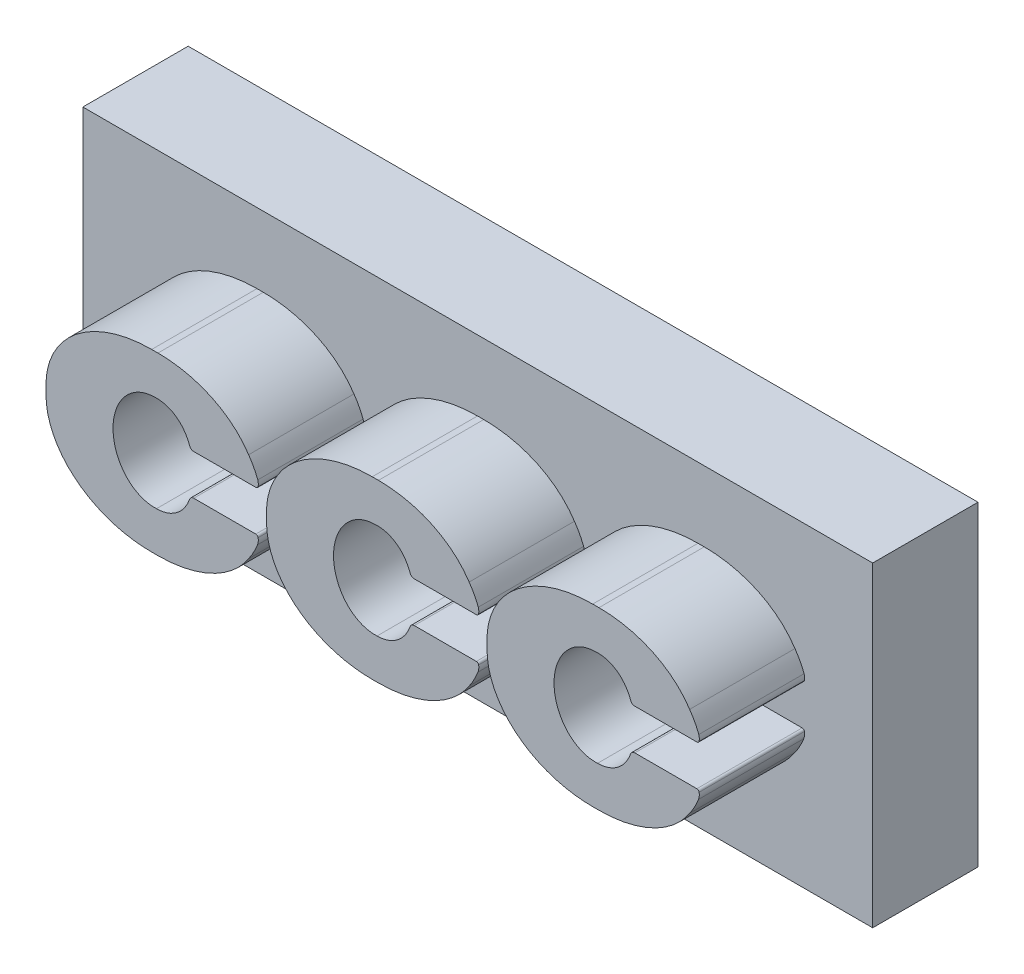
from build123d import *

# Parameters (mm, degrees)
BOSS_EXTRUDE1_DEPTH   = 2
BOSS_EXTRUDE1_2_DEPTH = 2
BOSS_EXTRUDE1_3_DEPTH = 2
SKETCH3_W             = 15
SKETCH3_H             = 6
BOSS_EXTRUDE2_DEPTH   = 2


with BuildPart() as part:
    # Sketch2 → Boss-Extrude1 (new body)
    with BuildSketch(Plane.XY):
        with BuildLine():
            Line((11.971746688, 19.734053644), (13.156348071, 19.734053669))
            ThreePointArc((13.156348071, 19.734053669), (13.179525443, 19.744291413), (13.193365664, 19.765515226))
            ThreePointArc((13.193365664, 19.765515226), (13.19739915, 19.821201025), (13.188063691, 19.8762467))
            ThreePointArc((13.188063691, 19.8762467), (13.111547426, 20.044582448), (13.014440765, 20.20194178))
            add(Edge.make_bspline(
                [(13.014440765, 20.20194178), (12.484950193, 21.013504257), (11.291530639, 21.013504258)],
                knots=[0.342748392, 0.342748392, 0.342748392, 1.381331673, 1.381331673, 1.381331673], degree=2, weights=[1, 0.868170932, 1]))
            Line((11.291530639, 21.013504258), (11.173022933, 21.013504277))
            add(Edge.make_bspline(
                [(11.173022933, 21.013504277), (9.165862366, 21.013504277), (9.16586234, 19.429763689)],
                knots=[4.81203319, 4.81203319, 4.81203319, 6.344970319, 6.344970319, 6.344970319], degree=2, weights=[1, 0.720364545, 1]))
            Line((9.16586234, 19.429763689), (9.165862348, 19.265041834))
            add(Edge.make_bspline(
                [(9.165862348, 19.265041834), (9.165862348, 17.681301204), (11.173022971, 17.681301277)],
                knots=[3.079807634, 3.079807634, 3.079807634, 4.612744788, 4.612744788, 4.612744788], degree=2, weights=[1, 0.720364536, 1]))
            Line((11.173022971, 17.681301277), (11.291530595, 17.681301231))
            add(Edge.make_bspline(
                [(11.291530595, 17.681301231), (12.48495018, 17.681301231), (13.014440765, 18.492863728)],
                knots=[1.760260959, 1.760260959, 1.760260959, 2.798844261, 2.798844261, 2.798844261], degree=2, weights=[1, 0.868170926, 1]))
            ThreePointArc((13.014440765, 18.492863728), (13.107795315, 18.64362681), (13.182053506, 18.804655688))
            ThreePointArc((13.182053506, 18.804655688), (13.196728173, 18.865824439), (13.194497656, 18.928689268))
            ThreePointArc((13.194497656, 18.928689268), (13.179302023, 18.955174053), (13.150618481, 18.965643321))
            Line((13.150618481, 18.965643321), (11.971746647, 18.965643321))
            ThreePointArc((11.971746647, 18.965643321), (11.923939268, 18.950452436), (11.893668965, 18.91045222))
            add(Edge.make_bspline(
                [(11.265198612, 18.440979368), (11.727360525, 18.440524679), (11.893668965, 18.91045222)],
                knots=[5.955155363, 5.955155363, 5.955155363, 7.020735544, 7.020735544, 7.020735544], degree=2, weights=[1, 0.86139323, 1]))
            add(Edge.make_bspline(
                [(11.189511072, 20.254442875), (10.402055714, 20.214623084), (10.44001251, 19.305183226), (10.477969307, 18.395743368), (11.265198612, 18.440979368)],
                knots=[3.181025595, 3.181025595, 3.181025595, 4.754799698, 4.754799698, 6.328573801, 6.328573801, 6.328573801], degree=2, weights=[1, 0.706053195, 1, 0.706053195, 1]))
            add(Edge.make_bspline(
                [(11.893668965, 19.789244771), (11.708556533, 20.312305593), (11.189511072, 20.254442875)],
                knots=[2.404042417, 2.404042417, 2.404042417, 3.565685694, 3.565685694, 3.565685694], degree=2, weights=[1, 0.83601209, 1]))
            ThreePointArc((11.893668965, 19.789244771), (11.923939288, 19.749244541), (11.971746688, 19.734053644))
        make_face()
    extrude(amount=BOSS_EXTRUDE1_DEPTH)



with BuildPart() as body_2:
    # Sketch2 → Boss-Extrude1 2 (new body)
    with BuildSketch(Plane.XY):
        with BuildLine():
            Line((7.784019348, 19.734053644), (8.968620799, 19.734053669))
            ThreePointArc((8.968620799, 19.734053669), (8.99179817, 19.744291413), (9.005638392, 19.765515226))
            ThreePointArc((9.005638392, 19.765515226), (9.009671877, 19.821201025), (9.000336418, 19.8762467))
            ThreePointArc((9.000336418, 19.8762467), (8.923820153, 20.044582448), (8.826713493, 20.20194178))
            add(Edge.make_bspline(
                [(8.826713493, 20.20194178), (8.29722292, 21.013504257), (7.103803365, 21.013504258)],
                knots=[0.342748392, 0.342748392, 0.342748392, 1.381331673, 1.381331673, 1.381331673], degree=2, weights=[1, 0.868170932, 1]))
            Line((7.103803365, 21.013504258), (6.98529566, 21.013504277))
            add(Edge.make_bspline(
                [(6.98529566, 21.013504277), (4.978135095, 21.013504277), (4.978135132, 19.429763689)],
                knots=[4.81203319, 4.81203319, 4.81203319, 6.344970317, 6.344970317, 6.344970317], degree=2, weights=[1, 0.720364545, 1]))
            Line((4.978135132, 19.429763689), (4.978135076, 19.265041834))
            add(Edge.make_bspline(
                [(4.978135076, 19.265041834), (4.978135076, 17.681301205), (6.985295697, 17.681301277)],
                knots=[3.079807634, 3.079807634, 3.079807634, 4.612744788, 4.612744788, 4.612744788], degree=2, weights=[1, 0.720364536, 1]))
            Line((6.985295697, 17.681301277), (7.103803322, 17.681301231))
            add(Edge.make_bspline(
                [(7.103803322, 17.681301231), (8.297222907, 17.681301231), (8.826713493, 18.492863728)],
                knots=[4.901853612, 4.901853612, 4.901853612, 5.940436915, 5.940436915, 5.940436915], degree=2, weights=[1, 0.868170926, 1]))
            ThreePointArc((8.826713493, 18.492863728), (8.920068042, 18.64362681), (8.994326233, 18.804655688))
            ThreePointArc((8.994326233, 18.804655688), (9.009000901, 18.865824439), (9.006770384, 18.928689268))
            ThreePointArc((9.006770384, 18.928689268), (8.99157475, 18.955174054), (8.962891207, 18.965643321))
            Line((8.962891207, 18.965643321), (7.784019375, 18.965643321))
            ThreePointArc((7.784019375, 18.965643321), (7.736211995, 18.950452436), (7.705941692, 18.91045222))
            add(Edge.make_bspline(
                [(7.07747134, 18.440979368), (7.539633252, 18.440524679), (7.705941692, 18.91045222)],
                knots=[5.955155363, 5.955155363, 5.955155363, 7.020735544, 7.020735544, 7.020735544], degree=2, weights=[1, 0.86139323, 1]))
            add(Edge.make_bspline(
                [(7.0017838, 20.254442875), (6.214328441, 20.214623084), (6.252285238, 19.305183226), (6.290242034, 18.395743368), (7.07747134, 18.440979368)],
                knots=[3.181025595, 3.181025595, 3.181025595, 4.754799698, 4.754799698, 6.328573801, 6.328573801, 6.328573801], degree=2, weights=[1, 0.706053195, 1, 0.706053195, 1]))
            add(Edge.make_bspline(
                [(7.705941692, 19.78924477), (7.520829261, 20.312305593), (7.0017838, 20.254442875)],
                knots=[2.404042417, 2.404042417, 2.404042417, 3.565685694, 3.565685694, 3.565685694], degree=2, weights=[1, 0.83601209, 1]))
            ThreePointArc((7.705941692, 19.78924477), (7.736211988, 19.74924456), (7.784019348, 19.734053644))
        make_face()
    extrude(amount=BOSS_EXTRUDE1_2_DEPTH)


with BuildPart() as body_3:
    # Sketch2 → Boss-Extrude1 3 (new body)
    with BuildSketch(Plane.XY):
        with BuildLine():
            Line((16.159473961, 19.734053644), (17.344075345, 19.734053669))
            ThreePointArc((17.344075345, 19.734053669), (17.367252716, 19.744291413), (17.381092938, 19.765515226))
            ThreePointArc((17.381092938, 19.765515226), (17.385126423, 19.821201025), (17.375790964, 19.8762467))
            ThreePointArc((17.375790964, 19.8762467), (17.2992747, 20.044582448), (17.202168039, 20.20194178))
            add(Edge.make_bspline(
                [(17.202168039, 20.20194178), (16.672677467, 21.013504257), (15.479257913, 21.013504258)],
                knots=[0.342748392, 0.342748392, 0.342748392, 1.381331673, 1.381331673, 1.381331673], degree=2, weights=[1, 0.868170932, 1]))
            Line((15.479257913, 21.013504258), (15.360750206, 21.013504277))
            add(Edge.make_bspline(
                [(15.360750206, 21.013504277), (13.353589639, 21.013504277), (13.353589613, 19.429763689)],
                knots=[4.81203319, 4.81203319, 4.81203319, 6.344970319, 6.344970319, 6.344970319], degree=2, weights=[1, 0.720364545, 1]))
            Line((13.353589613, 19.429763689), (13.353589622, 19.265041834))
            add(Edge.make_bspline(
                [(13.353589622, 19.265041834), (13.353589622, 17.681301204), (15.360750245, 17.681301277)],
                knots=[3.079807634, 3.079807634, 3.079807634, 4.612744788, 4.612744788, 4.612744788], degree=2, weights=[1, 0.720364536, 1]))
            Line((15.360750245, 17.681301277), (15.479257869, 17.681301231))
            add(Edge.make_bspline(
                [(15.479257869, 17.681301231), (16.672677453, 17.681301231), (17.202168039, 18.492863728)],
                knots=[1.760260959, 1.760260959, 1.760260959, 2.798844261, 2.798844261, 2.798844261], degree=2, weights=[1, 0.868170926, 1]))
            ThreePointArc((17.202168039, 18.492863728), (17.295522588, 18.64362681), (17.369780779, 18.804655688))
            ThreePointArc((17.369780779, 18.804655688), (17.384455447, 18.865824439), (17.38222493, 18.928689268))
            ThreePointArc((17.38222493, 18.928689268), (17.367029296, 18.955174053), (17.338345755, 18.965643321))
            Line((17.338345755, 18.965643321), (16.159473921, 18.965643321))
            ThreePointArc((16.159473921, 18.965643321), (16.111666541, 18.950452436), (16.081396238, 18.91045222))
            add(Edge.make_bspline(
                [(15.452925886, 18.440979368), (15.915087798, 18.440524679), (16.081396238, 18.91045222)],
                knots=[5.955155363, 5.955155363, 5.955155363, 7.020735544, 7.020735544, 7.020735544], degree=2, weights=[1, 0.86139323, 1]))
            add(Edge.make_bspline(
                [(15.377238346, 20.254442875), (14.589782987, 20.214623084), (14.627739784, 19.305183226), (14.665696581, 18.395743368), (15.452925886, 18.440979368)],
                knots=[3.181025595, 3.181025595, 3.181025595, 4.754799698, 4.754799698, 6.328573801, 6.328573801, 6.328573801], degree=2, weights=[1, 0.706053195, 1, 0.706053195, 1]))
            add(Edge.make_bspline(
                [(16.081396238, 19.789244771), (15.896283807, 20.312305593), (15.377238346, 20.254442875)],
                knots=[2.404042417, 2.404042417, 2.404042417, 3.565685694, 3.565685694, 3.565685694], degree=2, weights=[1, 0.83601209, 1]))
            ThreePointArc((16.081396238, 19.789244771), (16.111666561, 19.749244541), (16.159473961, 19.734053644))
        make_face()
    extrude(amount=BOSS_EXTRUDE1_3_DEPTH)


with BuildPart() as part_1:
    add(part.part)

    add(body_2.part)  # Boss-Extrude2 merges body 2

    add(body_3.part)  # Boss-Extrude2 merges body 3
    # Sketch3 → Boss-Extrude2 (add)
    with BuildSketch(Plane(origin=(0, 0, 0), x_dir=(-1, 0, 0), z_dir=(0, 0, -1))):
        with Locations((-11.178135076, 19.347504277)):
            Rectangle(SKETCH3_W, SKETCH3_H)
    extrude(amount=BOSS_EXTRUDE2_DEPTH)


solid = part_1.part
